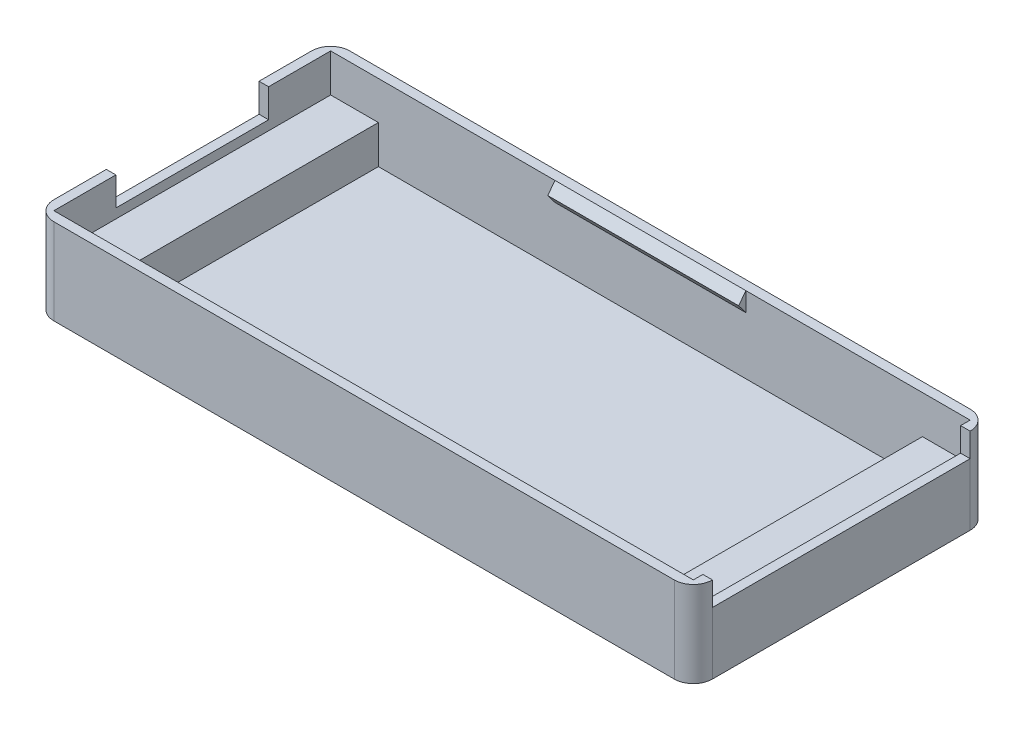
from build123d import *

# Parameters (mm, degrees)
BOSS_EXTRUDE1_DEPTH = 9
SKETCH4_W           = 67
SKETCH4_H           = 29
CUT_EXTRUDE1_DEPTH  = 4
SKETCH7_W           = 27
SKETCH7_H           = 2.5
CUT_EXTRUDE2_DEPTH  = 19
SKETCH9_W           = 57
SKETCH9_H           = 29
CUT_EXTRUDE3_DEPTH  = 4
SKETCH10_W          = 16
SKETCH10_H          = 3
CUT_EXTRUDE4_DEPTH  = 4
BOSS_EXTRUDE4_DEPTH = 10


with BuildPart() as part:
    # Sketch1 → Boss-Extrude1 (new body)
    with BuildSketch(Plane(origin=(0, 0, 0), x_dir=(1, 0, 0), z_dir=(0, 1, 0))):
        with BuildLine():
            Line((-32.5, -15.5), (32.5, -15.5))
            ThreePointArc((32.5, -15.5), (33.914213562, -14.914213562), (34.5, -13.5))
            Line((34.5, -13.5), (34.5, 13.5))
            ThreePointArc((34.5, 13.5), (33.914213562, 14.914213562), (32.5, 15.5))
            Line((32.5, 15.5), (-32.5, 15.5))
            ThreePointArc((-32.5, 15.5), (-33.914213562, 14.914213562), (-34.5, 13.5))
            Line((-34.5, 13.5), (-34.5, -13.5))
            ThreePointArc((-34.5, -13.5), (-33.914213562, -14.914213562), (-32.5, -15.5))
        make_face()
    extrude(amount=BOSS_EXTRUDE1_DEPTH)

    # Sketch4 → Cut-Extrude1 (cut)
    with BuildSketch(Plane(origin=(0, 9, 0), x_dir=(1, 0, 0), z_dir=(0, 1, 0))):
        Rectangle(SKETCH4_W, SKETCH4_H)
    extrude(amount=-CUT_EXTRUDE1_DEPTH, mode=Mode.SUBTRACT)

    # Sketch7 → Cut-Extrude2 (cut)
    with BuildSketch(Plane.ZY.offset(-33.5)):
        with Locations((0, 7.75)):
            Rectangle(SKETCH7_W, SKETCH7_H)
    extrude(amount=-CUT_EXTRUDE2_DEPTH, mode=Mode.SUBTRACT)

    # Sketch9 → Cut-Extrude3 (cut)
    with BuildSketch(Plane(origin=(0, 5, 0), x_dir=(1, 0, 0), z_dir=(0, 1, 0))):
        Rectangle(SKETCH9_W, SKETCH9_H)
    extrude(amount=-CUT_EXTRUDE3_DEPTH, mode=Mode.SUBTRACT)

    # Sketch10 → Cut-Extrude4 (cut)
    with BuildSketch(Plane(origin=(-33.5, 0, 0), x_dir=(0, 0, -1), z_dir=(1, 0, 0))):
        with Locations((0, 7.5)):
            Rectangle(SKETCH10_W, SKETCH10_H)
    extrude(amount=-CUT_EXTRUDE4_DEPTH, mode=Mode.SUBTRACT)

    # Sketch13 → Boss-Extrude4 (add, symmetric)
    with BuildSketch(Plane(origin=(0, 0, 0), x_dir=(0, 0, -1), z_dir=(1, 0, 0))):
        Polygon((14.5, 7), (14.5, 9), (13.75, 8), align=None)
        Polygon((-13.75, 8), (-14.5, 7), (-14.5, 9), align=None)
    extrude(amount=BOSS_EXTRUDE4_DEPTH, both=True)


solid = part.part
